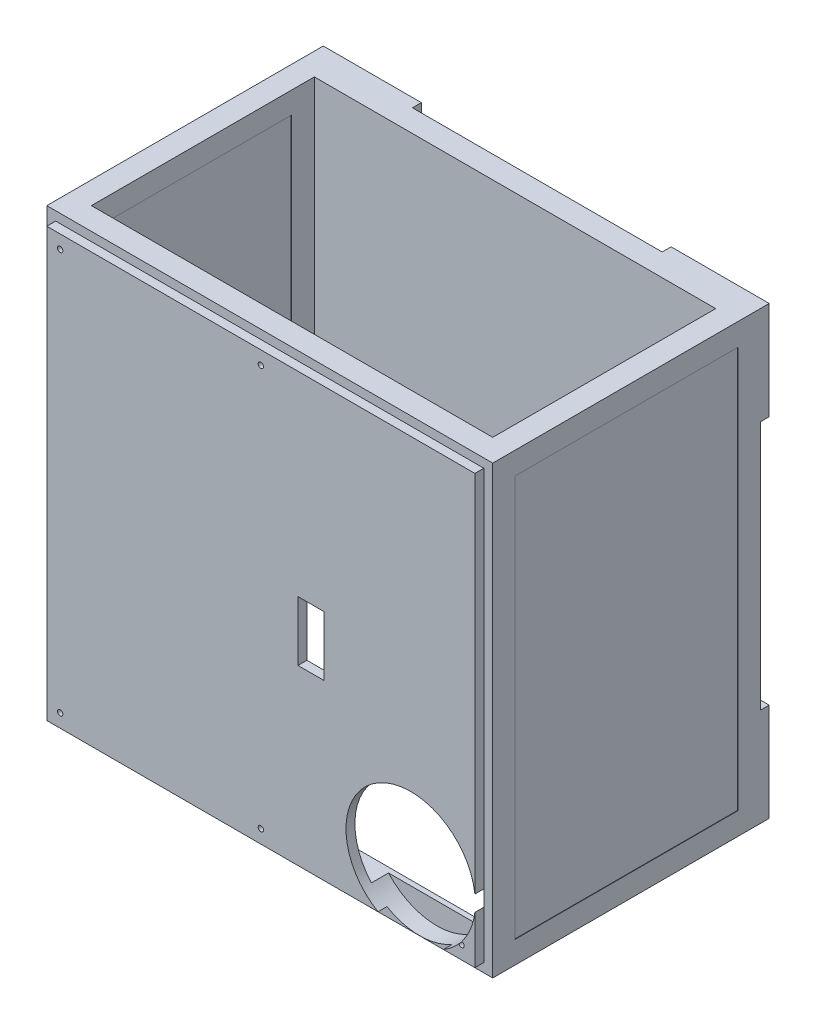
from build123d import *

# Parameters (mm, degrees)
SKETCH_1_W                = 1000
SKETCH_1_H                = 1000
EXTRUDE_1_DEPTH           = 600
SKETCH_2_W                = 900
SKETCH_2_H                = 500
CUT_EXTRUDE_3_DEPTH       = 1
SKETCH_5_W                = 500
SKETCH_5_H                = 900
CUT_EXTRUDE_4_DEPTH       = 1
SKETCH_8_W                = 960
SKETCH_8_H                = 960
EXTRUDE_5_DEPTH           = 20
SKETCH_9_W                = 450
SKETCH_9_H                = 500
CUT_EXTRUDE_5_DEPTH       = 20
EXTRUDE_7_DEPTH           = 20
SKETCH_10_R               = 6
CUT_EXTRUDE_6_DEPTH       = 50
SCALE_3_SCALE             = 0.7
SKETCH_13_W               = 632
SKETCH_13_H               = 632
CUT_EXTRUDE_9_DEPTH       = 349
SKETCH_14_W               = 40.921535405
SKETCH_14_H               = 93.626348877
CUT_EXTRUDE_10_DEPTH      = 48
SKETCH_16_W               = 630
SKETCH_16_H               = 350
CUT_EXTRUDE_11_DEPTH      = 952
CUT_EXTRUDE_14_DEPTH      = 30
CUT_EXTRUDE_14_DEPTH_BACK = 41
SKETCH_17_R               = 101.559336937
SCALE_4_SCALE             = 1.3


with BuildPart() as part:
    # 草图1 → 凸台-拉伸1 (new body)
    with BuildSketch(Plane.XY):
        with Locations((450, -472.091412742)):
            Rectangle(SKETCH_1_W, SKETCH_1_H)
    extrude(amount=EXTRUDE_1_DEPTH)

    # 草图2 → 切除-拉伸3 (cut)
    with BuildSketch(Plane.XZ.offset(972.091412742)):
        with Locations((450, 300)):
            Rectangle(SKETCH_2_W, SKETCH_2_H)
    cut_extrude_3 = extrude(amount=-CUT_EXTRUDE_3_DEPTH, mode=Mode.SUBTRACT)

    # 草图5 → 切除-拉伸4 (cut)
    with BuildSketch(Plane(origin=(950, 0, 0), x_dir=(0, 0, -1), z_dir=(1, 0, 0))):
        with Locations((-300, -472.091412742)):
            Rectangle(SKETCH_5_W, SKETCH_5_H)
    cut_extrude_4 = extrude(amount=-CUT_EXTRUDE_4_DEPTH, mode=Mode.SUBTRACT)

    # 镜向1: 切除-拉伸3 across plane
    add(cut_extrude_3.mirror(Plane.ZX.offset(-472.091412742)), mode=Mode.SUBTRACT)

    # 镜向2: 切除-拉伸4 across plane
    add(cut_extrude_4.mirror(Plane.ZY.offset(-450)), mode=Mode.SUBTRACT)

    # 草图8 → 凸台-拉伸5 (add)
    with BuildSketch(Plane.XY.offset(600)):
        with Locations((450, -472.091412742)):
            Rectangle(SKETCH_8_W, SKETCH_8_H)
    extrude(amount=EXTRUDE_5_DEPTH)

    # 草图9 → 切除-拉伸5 (cut)
    with BuildSketch(Plane.XZ.offset(971.091412742)):
        with Locations((675, 300)):
            Rectangle(SKETCH_9_W, SKETCH_9_H)
    cut_extrude_5 = extrude(amount=-CUT_EXTRUDE_5_DEPTH, mode=Mode.SUBTRACT)

    # 镜向3: 切除-拉伸5 across plane
    add(cut_extrude_5.mirror(Plane.ZX.offset(-472.091412742)), mode=Mode.SUBTRACT)

    # 草图11 → 凸台-拉伸7 (add)
    with BuildSketch(Plane(origin=(0, 0, 0), x_dir=(-1, 0, 0), z_dir=(0, 0, -1))):
        with BuildLine():
            Line((-20, -192.091412742), (50, -192.091412742))
            Line((50, -192.091412742), (50, 27.908587258))
            Line((50, 27.908587258), (-170, 27.908587258))
            Line((-170, 27.908587258), (-170, -42.091412742))
            Line((-170, -42.091412742), (-80, -42.091412742))
            ThreePointArc((-80, -42.091412742), (-37.573593129, -59.665005871), (-20, -102.091412742))
            Line((-20, -102.091412742), (-20, -192.091412742))
        make_face()
        with BuildLine():
            Line((50, -972.091412742), (50, -752.091412742))
            Line((50, -752.091412742), (-20, -752.091412742))
            Line((-20, -752.091412742), (-20, -842.091412742))
            ThreePointArc((-20, -842.091412742), (-37.573593129, -884.517819614), (-80, -902.091412742))
            Line((-80, -902.091412742), (-170, -902.091412742))
            Line((-170, -902.091412742), (-170, -972.091412742))
            Line((-170, -972.091412742), (50, -972.091412742))
        make_face()
        with BuildLine():
            Line((-730, -42.091412742), (-730, 27.908587258))
            Line((-730, 27.908587258), (-950, 27.908587258))
            Line((-950, 27.908587258), (-950, -192.091412742))
            Line((-950, -192.091412742), (-880, -192.091412742))
            Line((-880, -192.091412742), (-880, -102.091412742))
            ThreePointArc((-880, -102.091412742), (-862.426406871, -59.665005871), (-820, -42.091412742))
            Line((-820, -42.091412742), (-730, -42.091412742))
        make_face()
        with BuildLine():
            Line((-950, -972.091412742), (-730, -972.091412742))
            Line((-730, -972.091412742), (-730, -902.091412742))
            Line((-730, -902.091412742), (-820, -902.091412742))
            ThreePointArc((-820, -902.091412742), (-862.426406871, -884.517819614), (-880, -842.091412742))
            Line((-880, -842.091412742), (-880, -752.091412742))
            Line((-880, -752.091412742), (-950, -752.091412742))
            Line((-950, -752.091412742), (-950, -972.091412742))
        make_face()
    extrude(amount=EXTRUDE_7_DEPTH)

    # 草图10 → 切除-拉伸6 (cut)
    with BuildSketch(Plane.XY.offset(620)):
        with Locations((450, -922.091412742)):
            Circle(SKETCH_10_R)
        with Locations((900, -922.091412742)):
            Circle(SKETCH_10_R)
        with Locations(Location((0, -922.091412742, 0), (0, 0, 180))):
            Circle(SKETCH_10_R)
        with Locations((0, -22.091412742)):
            Circle(SKETCH_10_R)
        with Locations(Location((450, -22.091412742, 0), (0, 0, 180))):
            Circle(SKETCH_10_R)
    extrude(amount=-CUT_EXTRUDE_6_DEPTH, mode=Mode.SUBTRACT)


with BuildPart() as part_1:
    # 缩放比例3: scaled about (446.683072294, -472.087239324, 308.272574941)
    add(part.part.scale(SCALE_3_SCALE).moved(Location((134.004921688, -141.626171797, 92.481772482))))

    # 草图13 → 切除-拉伸9 (cut)
    with BuildSketch(Plane.XY.offset(512.481772482)):
        with Locations((449.004921688, -472.090160717)):
            Rectangle(SKETCH_13_W, SKETCH_13_H)
    extrude(amount=-CUT_EXTRUDE_9_DEPTH, mode=Mode.SUBTRACT)

    # 草图14 → 切除-拉伸10 (cut)
    with BuildSketch(Plane.XY.offset(526.481772482)):
        with Locations((527.648380446, -489.242485135)):
            Rectangle(SKETCH_14_W, SKETCH_14_H)
    extrude(amount=-CUT_EXTRUDE_10_DEPTH, mode=Mode.SUBTRACT)

    # 草图16 → 切除-拉伸11 (cut)
    with BuildSketch(Plane(origin=(0, -122.790160717, 0), x_dir=(1, 0, 0), z_dir=(0, 1, 0))):
        with Locations((449.004921688, -302.481772482)):
            Rectangle(SKETCH_16_W, SKETCH_16_H)
    extrude(amount=-CUT_EXTRUDE_11_DEPTH, mode=Mode.SUBTRACT)

    # 草图17 → 切除-拉伸14 (cut, two sides: drawn at the far end of the back side and taken through both)
    with BuildSketch(Plane.XY.offset(526.481772482).offset(-CUT_EXTRUDE_14_DEPTH_BACK)):
        with Locations((684.208488582, -720.433496124)):
            Circle(SKETCH_17_R)
    extrude(amount=CUT_EXTRUDE_14_DEPTH + CUT_EXTRUDE_14_DEPTH_BACK, mode=Mode.SUBTRACT)


with BuildPart() as part_2:
    # 缩放比例4: scaled about (445.645805115, -468.553494774, 264.919094527)
    add(part_1.part.scale(SCALE_4_SCALE).moved(Location((-133.693741535, 140.566048432, -79.475728358))))


solid = part_2.part
